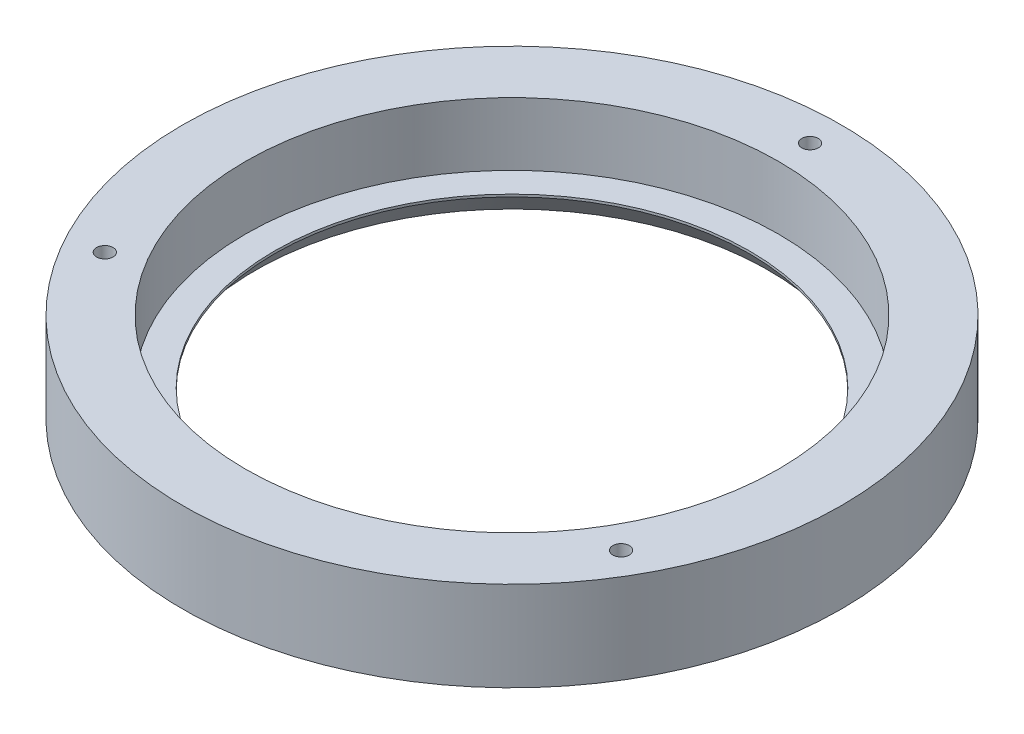
from build123d import *

# Parameters (mm, degrees)
SKETCH3_R          = 1.7
CUT_EXTRUDE1_DEPTH = 98.929821811
CIRPATTERN1_COUNT  = 3
CUT_EXTRUDE2_DEPTH = 3
CIRPATTERN2_COUNT  = 3


with BuildPart() as part:
    # Sketch2 → Revolve1 (revolve)
    with BuildSketch(Plane.XY):
        Polygon((53, 0), (68, 0), (68, 18.5), (55, 18.5), (55, 5.5), (49, 5.5), (49, 5), align=None)
    revolve(axis=Axis((0, -18.5, 0), (0, 1, 0)))

    # Sketch3 → Cut-Extrude1 (cut, through all)
    with BuildSketch(Plane(origin=(0, 18.5, 0), x_dir=(1, 0, 0), z_dir=(0, 1, 0))):
        with Locations(Location((0, 61.5, 0), (0, 0, 180))):
            Circle(SKETCH3_R)
    cut_extrude1 = extrude(amount=-CUT_EXTRUDE1_DEPTH, mode=Mode.SUBTRACT)

    # CirPattern1: Cut-Extrude1 ×3 about axis
    cirpattern1_axis = Axis((0, 0, 0), (0, 1, 0))
    for i in range(1, CIRPATTERN1_COUNT):
        add(cut_extrude1.rotate(cirpattern1_axis, i * 360 / CIRPATTERN1_COUNT), mode=Mode.SUBTRACT)

    # Sketch4 → Cut-Extrude2 (cut)
    with BuildSketch(Plane.XZ):
        Polygon((-54.935562333, 33.651185103), (-56.610562333, 30.75), (-54.935562333, 27.848814897), (-51.585562333, 27.848814897), (-49.910562333, 30.75), (-51.585562333, 33.651185103), align=None)
    cut_extrude2 = extrude(amount=-CUT_EXTRUDE2_DEPTH, mode=Mode.SUBTRACT)

    # CirPattern2: Cut-Extrude2 ×3 about axis
    cirpattern2_axis = Axis((0, 0, 0), (0, 1, 0))
    for i in range(1, CIRPATTERN2_COUNT):
        add(cut_extrude2.rotate(cirpattern2_axis, i * 360 / CIRPATTERN2_COUNT), mode=Mode.SUBTRACT)


solid = part.part
